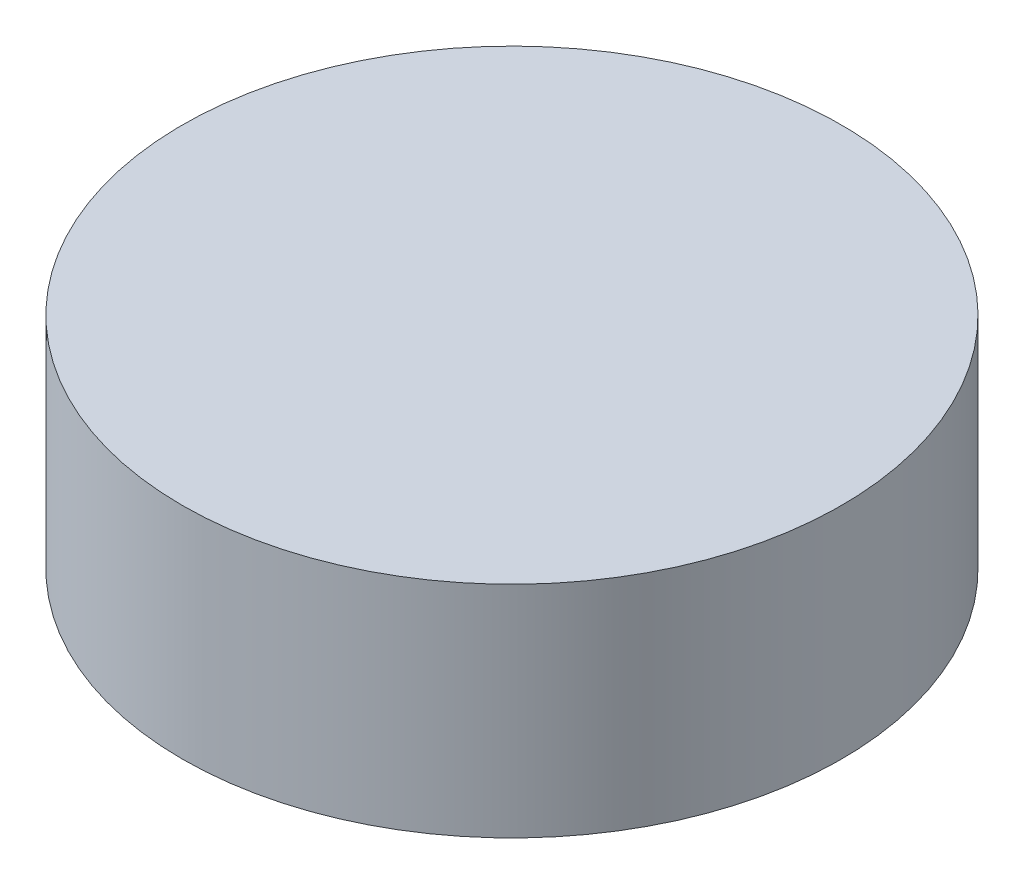
from build123d import *

# Parameters (mm, degrees)
ESBO_O1_R                = 30
RESSALTO_EXTRUS_O1_DEPTH = 20


with BuildPart() as part:
    # Esboço1 → Ressalto-extrusão1 (new body)
    with BuildSketch(Plane(origin=(0, 0, 0), x_dir=(1, 0, 0), z_dir=(0, 1, 0))):
        with Locations(Location((0, 0, 0), (0, 0, 270))):
            Circle(ESBO_O1_R)
    extrude(amount=RESSALTO_EXTRUS_O1_DEPTH)


solid = part.part
